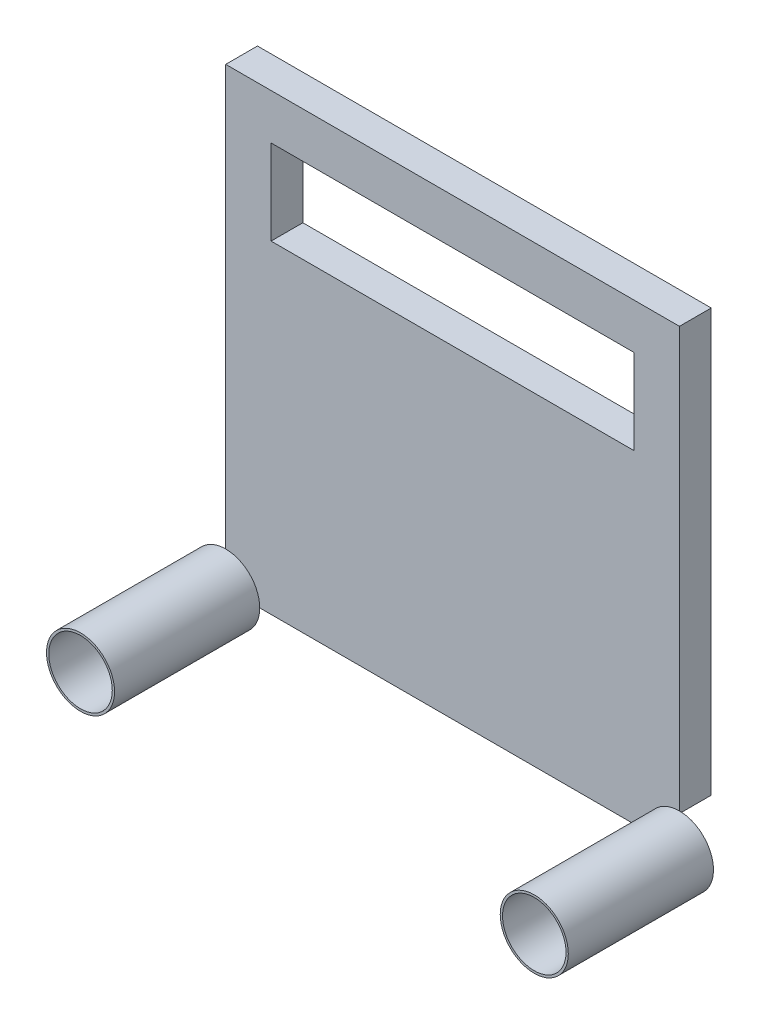
from build123d import *

# Parameters (mm, degrees)
SKETCH1_W           = 50
SKETCH1_H           = 50
BOSS_EXTRUDE1_DEPTH = 3.5
SKETCH2_R           = 3.75
BOSS_EXTRUDE2_DEPTH = 16
SKETCH3_R           = 3.5
CUT_EXTRUDE2_DEPTH  = 19.5
SKETCH4_W           = 40
SKETCH4_H           = 9.367616821
CUT_EXTRUDE3_DEPTH  = 19.5


with BuildPart() as part:
    # Sketch1 → Boss-Extrude1 (new body)
    with BuildSketch(Plane.XY):
        with Locations((25, 25)):
            Rectangle(SKETCH1_W, SKETCH1_H)
    extrude(amount=BOSS_EXTRUDE1_DEPTH)

    # Sketch2 → Boss-Extrude2 (add)
    with BuildSketch(Plane.XY.offset(3.5)):
        Circle(SKETCH2_R)
        with Locations(Location((50, 0, 0), (0, 0, 180))):
            Circle(SKETCH2_R)
    extrude(amount=BOSS_EXTRUDE2_DEPTH)

    # Sketch3 → Cut-Extrude2 (cut)
    with BuildSketch(Plane.XY.offset(19.5)):
        Circle(SKETCH3_R)
        with Locations((50, 0)):
            Circle(SKETCH3_R)
    extrude(amount=-CUT_EXTRUDE2_DEPTH, mode=Mode.SUBTRACT)

    # Sketch4 → Cut-Extrude3 (cut)
    with BuildSketch(Plane.XY.offset(3.5)):
        with Locations((25, 40.31619159)):
            Rectangle(SKETCH4_W, SKETCH4_H)
    extrude(amount=-CUT_EXTRUDE3_DEPTH, mode=Mode.SUBTRACT)


solid = part.part
